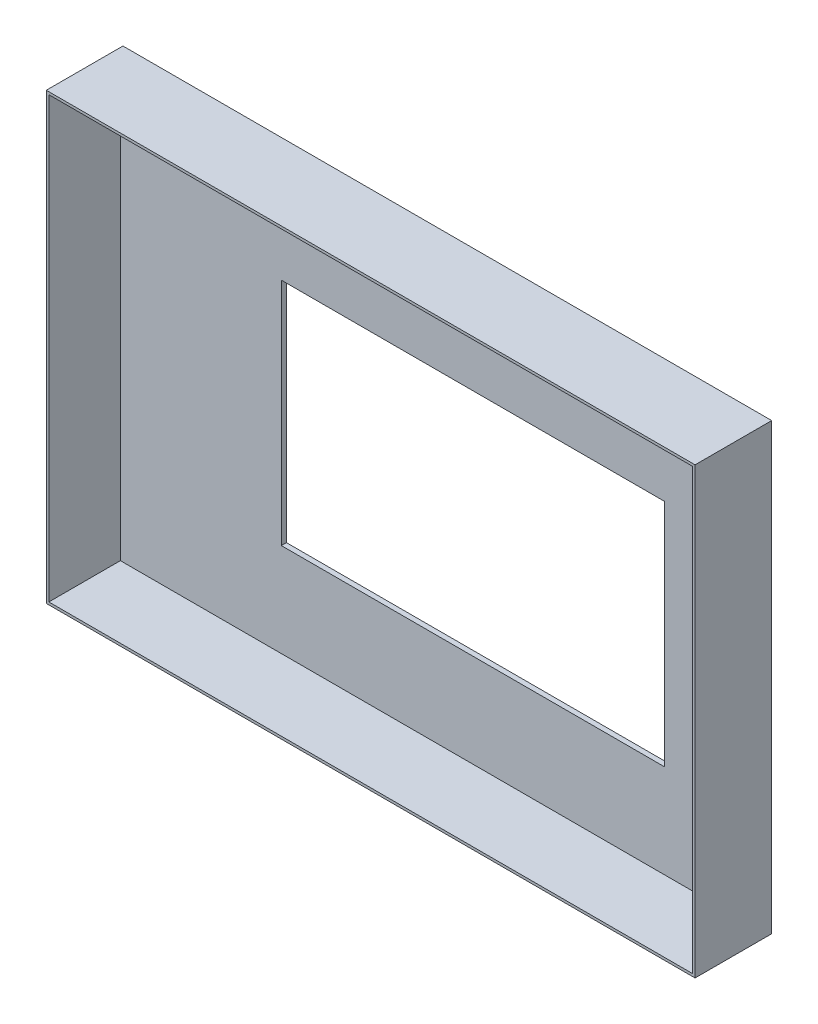
from build123d import *

# Parameters (mm, degrees)
SKETCH1_W           = 127
SKETCH1_H           = 87
BOSS_EXTRUDE1_DEPTH = 15
SKETCH2_W           = 126
SKETCH2_H           = 86
CUT_EXTRUDE1_DEPTH  = 14
SKETCH3_W           = 75
SKETCH3_H           = 45
CUT_EXTRUDE2_DEPTH  = 1


with BuildPart() as part:
    # Sketch1 → Boss-Extrude1 (new body)
    with BuildSketch(Plane.XY):
        with Locations((1.905, -16.195)):
            Rectangle(SKETCH1_W, SKETCH1_H)
    extrude(amount=BOSS_EXTRUDE1_DEPTH)

    # Sketch2 → Cut-Extrude1 (cut)
    with BuildSketch(Plane.XY.offset(15)):
        with Locations((1.905, -16.195)):
            Rectangle(SKETCH2_W, SKETCH2_H)
    extrude(amount=-CUT_EXTRUDE1_DEPTH, mode=Mode.SUBTRACT)

    # Sketch3 → Cut-Extrude2 (cut)
    with BuildSketch(Plane(origin=(0, 0, 0), x_dir=(-1, 0, 0), z_dir=(0, 0, -1))):
        with Locations((-7.905, -18.383474077)):
            Rectangle(SKETCH3_W, SKETCH3_H)
    extrude(amount=-CUT_EXTRUDE2_DEPTH, mode=Mode.SUBTRACT)


solid = part.part
